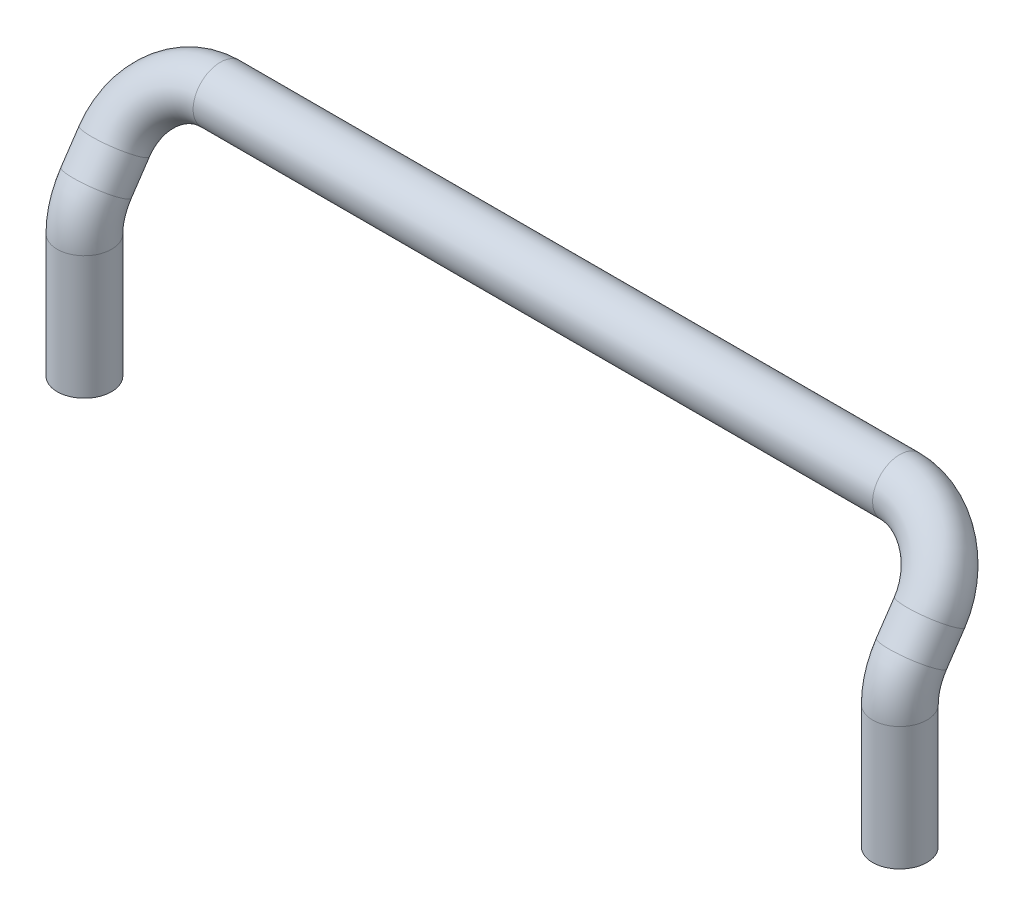
from build123d import *

# Parameters (mm, degrees)
SKETCH2_R  = 4
TAP1_D     = 4.134
TAP1_DEPTH = 12
TAP1_TIP   = 1.2419789


with BuildPart() as part:
    # Sweep1: sweep along a curve in space
    with BuildLine() as sweep1_path:
        Line((0, 0, 0), (0, 18.16, 0))
        ThreePointArc((0, 18.16, 0), (0, 21.091478934, -0.439328933), (0, 23.765381166, -1.718713748))
        Line((0, 23.765381166, -1.718713748), (0, 27.718713748, -4.394618834))
        ThreePointArc((0, 27.718713748, -4.394618834), (2.928932188, 33.574467414, -8.358221868), (10, 36, -10))
        Line((10, 36, -10), (110, 36, -10))
        ThreePointArc((120, 27.718713748, -4.394618834), (117.071067812, 33.574467414, -8.358221868), (110, 36, -10))
        Line((120, 27.718713748, -4.394618834), (120, 23.765381166, -1.718713748))
        ThreePointArc((120, 18.16, 0), (120, 21.091478934, -0.439328933), (120, 23.765381166, -1.718713748))
        Line((120, 18.16, 0), (120, 0, 0))
    # Sketch2 → Sweep1 (sweep)
    with BuildSketch(Plane(origin=(0, 0, 0), x_dir=(1, 0, 0), z_dir=(0, 1, 0))):
        Circle(SKETCH2_R)
    sweep(path=sweep1_path.line)

    # Tap1
    with Locations(Plane(origin=(0, 0, 0), x_dir=(-1, 0, 0), z_dir=(0, -1, 0))):
        with Locations((0, 0), (-120, 0)):
            Hole(TAP1_D / 2, depth=TAP1_DEPTH)
            with Locations((0, 0, -(TAP1_DEPTH + TAP1_TIP / 2))):  # 118° drill point
                Cone(0, TAP1_D / 2, TAP1_TIP, mode=Mode.SUBTRACT)


solid = part.part
